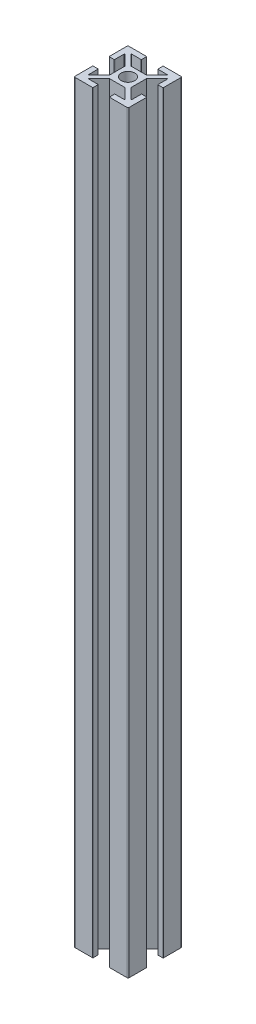
from build123d import *

# Parameters (mm, degrees)
SKETCH1_R           = 2.5
BOSS_EXTRUDE2_DEPTH = 280


with BuildPart() as part:
    # Sketch1 → Boss-Extrude2 (new body)
    with BuildSketch(Plane(origin=(0, 0, 0), x_dir=(1, 0, 0), z_dir=(0, 1, 0))):
        with BuildLine():
            Line((-9.896296296, 3), (-8.196296296, 3))
            ThreePointArc((-8.196296296, 3), (-8.090230279, 3.043933983), (-8.046296296, 3.15))
            Line((-8.046296296, 3.15), (-8.046296296, 6.586184513))
            ThreePointArc((-8.046296296, 6.586184513), (-7.954097251, 6.724600732), (-7.790842301, 6.692859041))
            Line((-7.790842301, 6.692859041), (-4, 2.945390222))
            Line((-4, 2.945390222), (-4, -2.945390222))
            Line((-4, -2.945390222), (-7.790842301, -6.692859041))
            ThreePointArc((-7.790842301, -6.692859041), (-7.954097251, -6.724600732), (-8.046296296, -6.586184513))
            Line((-8.046296296, -6.586184513), (-8.046296296, -3.15))
            ThreePointArc((-8.046296296, -3.15), (-8.090230279, -3.043933983), (-8.196296296, -3))
            Line((-8.196296296, -3), (-9.896296296, -3))
            ThreePointArc((-9.896296296, -3), (-10.002362313, -3.043933983), (-10.046296296, -3.15))
            Line((-10.046296296, -3.15), (-10.046296296, -9.65))
            ThreePointArc((-10.046296296, -9.65), (-9.94378367, -9.897487373), (-9.696296296, -10))
            Line((-9.696296296, -10), (-3.196296296, -10))
            ThreePointArc((-3.196296296, -10), (-3.090230279, -9.956066017), (-3.046296296, -9.85))
            Line((-3.046296296, -9.85), (-3.046296296, -8.15))
            ThreePointArc((-3.046296296, -8.15), (-3.090230279, -8.043933983), (-3.196296296, -8))
            Line((-3.196296296, -8), (-6.614381093, -8))
            ThreePointArc((-6.614381093, -8), (-6.753127587, -7.9070036), (-6.719835089, -7.743325472))
            Line((-6.719835089, -7.743325472), (-2.93318409, -4))
            Line((-2.93318409, -4), (2.93318409, -4))
            Line((2.93318409, -4), (6.719835089, -7.743325472))
            ThreePointArc((6.719835089, -7.743325472), (6.753127587, -7.9070036), (6.614381093, -8))
            Line((6.614381093, -8), (3.196296296, -8))
            ThreePointArc((3.196296296, -8), (3.090230279, -8.043933983), (3.046296296, -8.15))
            Line((3.046296296, -8.15), (3.046296296, -9.85))
            ThreePointArc((3.046296296, -9.85), (3.090230279, -9.956066017), (3.196296296, -10))
            Line((3.196296296, -10), (9.696296296, -10))
            ThreePointArc((9.696296296, -10), (9.94378367, -9.897487373), (10.046296296, -9.65))
            Line((10.046296296, -9.65), (10.046296296, -3.15))
            ThreePointArc((10.046296296, -3.15), (10.002362313, -3.043933983), (9.896296296, -3))
            Line((9.896296296, -3), (8.196296296, -3))
            ThreePointArc((8.196296296, -3), (8.090230279, -3.043933983), (8.046296296, -3.15))
            Line((8.046296296, -3.15), (8.046296296, -6.586184513))
            ThreePointArc((8.046296296, -6.586184513), (7.954097251, -6.724600732), (7.790842301, -6.692859041))
            Line((7.790842301, -6.692859041), (4, -2.945390222))
            Line((4, -2.945390222), (4, 2.945390222))
            Line((4, 2.945390222), (7.790842301, 6.692859041))
            ThreePointArc((7.790842301, 6.692859041), (7.954097251, 6.724600732), (8.046296296, 6.586184513))
            Line((8.046296296, 6.586184513), (8.046296296, 3.15))
            ThreePointArc((8.046296296, 3.15), (8.090230279, 3.043933983), (8.196296296, 3))
            Line((8.196296296, 3), (9.896296296, 3))
            ThreePointArc((9.896296296, 3), (10.002362313, 3.043933983), (10.046296296, 3.15))
            Line((10.046296296, 3.15), (10.046296296, 9.65))
            ThreePointArc((10.046296296, 9.65), (9.94378367, 9.897487373), (9.696296296, 10))
            Line((9.696296296, 10), (3.196296296, 10))
            ThreePointArc((3.196296296, 10), (3.090230279, 9.956066017), (3.046296296, 9.85))
            Line((3.046296296, 9.85), (3.046296296, 8.15))
            ThreePointArc((3.046296296, 8.15), (3.090230279, 8.043933983), (3.196296296, 8))
            Line((3.196296296, 8), (6.614381093, 8))
            ThreePointArc((6.614381093, 8), (6.753127587, 7.9070036), (6.719835089, 7.743325472))
            Line((6.719835089, 7.743325472), (2.93318409, 4))
            Line((2.93318409, 4), (-2.93318409, 4))
            Line((-2.93318409, 4), (-6.719835089, 7.743325472))
            ThreePointArc((-6.719835089, 7.743325472), (-6.753127587, 7.9070036), (-6.614381093, 8))
            Line((-6.614381093, 8), (-3.196296296, 8))
            ThreePointArc((-3.196296296, 8), (-3.090230279, 8.043933983), (-3.046296296, 8.15))
            Line((-3.046296296, 8.15), (-3.046296296, 9.85))
            ThreePointArc((-3.046296296, 9.85), (-3.090230279, 9.956066017), (-3.196296296, 10))
            Line((-3.196296296, 10), (-9.696296296, 10))
            ThreePointArc((-9.696296296, 10), (-9.94378367, 9.897487373), (-10.046296296, 9.65))
            Line((-10.046296296, 9.65), (-10.046296296, 3.15))
            ThreePointArc((-10.046296296, 3.15), (-10.002362313, 3.043933983), (-9.896296296, 3))
        make_face()
        with Locations(Location((0, 0, 0), (0, 0, 270))):
            Circle(SKETCH1_R, mode=Mode.SUBTRACT)
    extrude(amount=BOSS_EXTRUDE2_DEPTH)


solid = part.part
